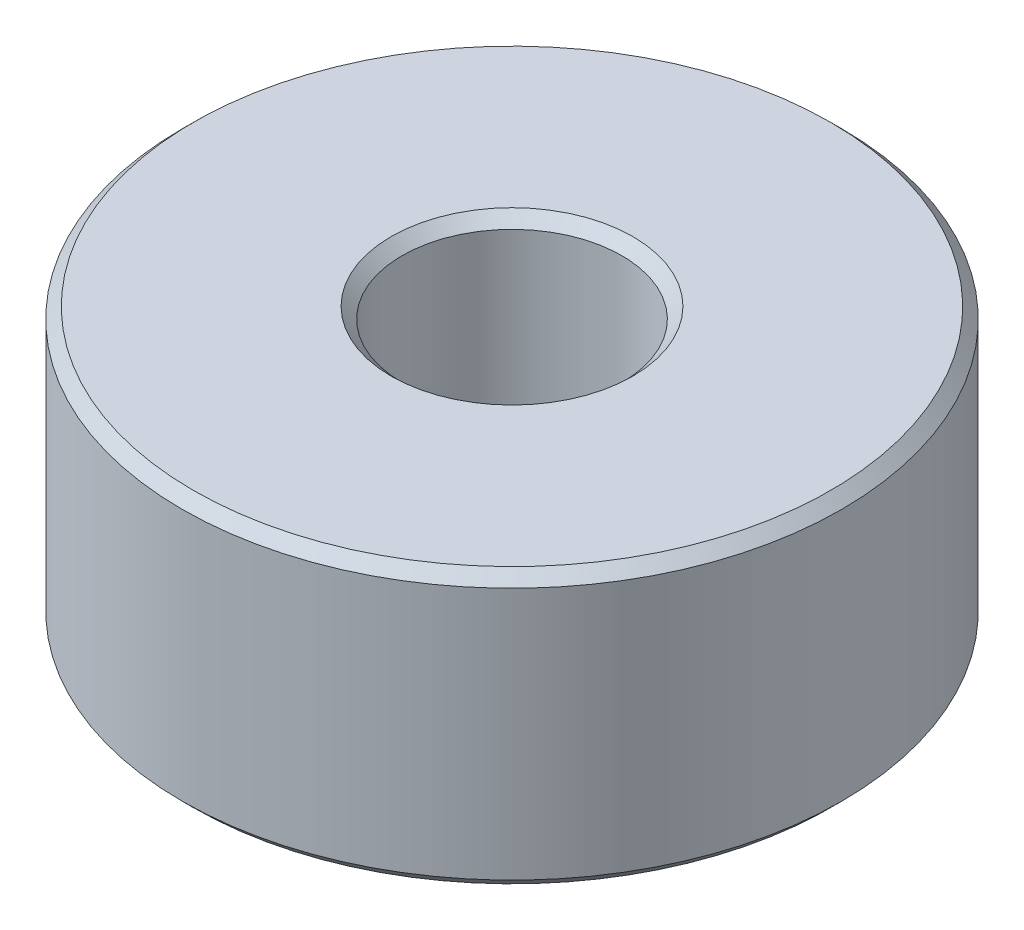
from build123d import *

# Parameters (mm, degrees)
SKETCH2_R           = 3
SKETCH2_R_2         = 1
BOSS_EXTRUDE1_DEPTH = 2.5
CHAMFER1_SIZE       = 0.1


with BuildPart() as part:
    # Sketch2 → Boss-Extrude1 (new body)
    with BuildSketch(Plane(origin=(0, 0, 0), x_dir=(1, 0, 0), z_dir=(0, 1, 0))):
        with Locations(Location((0, 0, 0), (0, 0, 270))):
            Circle(SKETCH2_R)
        with Locations(Location((0, 0, 0), (0, 0, 270))):
            Circle(SKETCH2_R_2, mode=Mode.SUBTRACT)
    extrude(amount=BOSS_EXTRUDE1_DEPTH)

    # Chamfer1
    chamfer1_edges = [part.edges().sort_by_distance(p)[0] for p in [
        (0, 0, -3),
        (0, 2.5, -3),
        (0, 0, -1),
        (0, 2.5, -1),
    ]]
    chamfer(chamfer1_edges, length=CHAMFER1_SIZE)


solid = part.part
